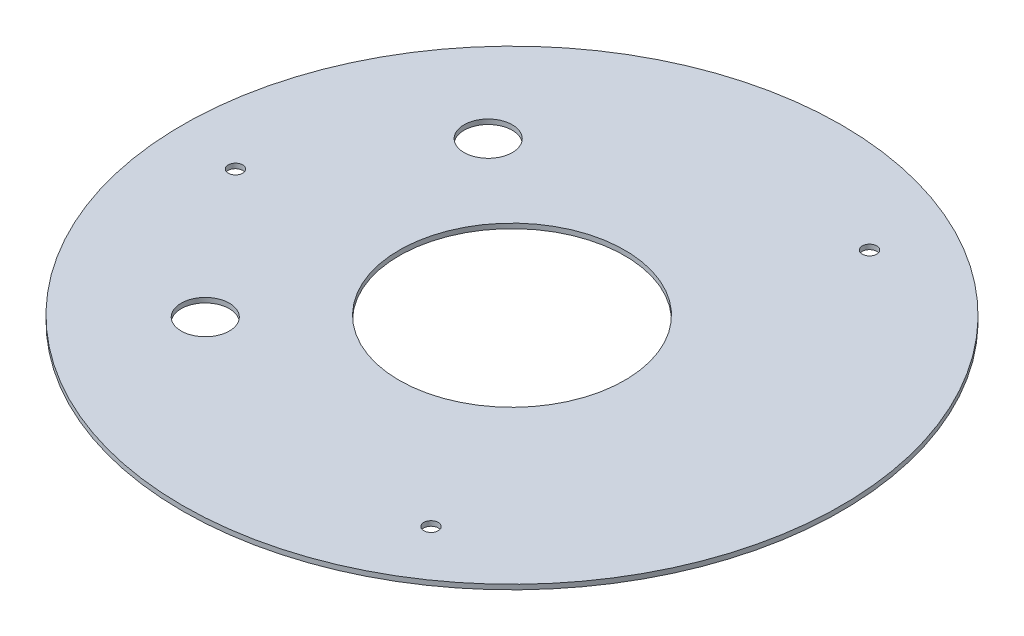
from build123d import *

# Parameters (mm, degrees)
SKETCH1_R           = 68.369999998
SKETCH1_R_2         = 23.401
BOSS_EXTRUDE1_DEPTH = 1
SKETCH2_R           = 1.5
CUT_EXTRUDE1_DEPTH  = 10
SKETCH6_R           = 5
CUT_EXTRUDE2_DEPTH  = 10


with BuildPart() as part:
    # Sketch1 → Boss-Extrude1 (new body)
    with BuildSketch(Plane(origin=(0, 0, 0), x_dir=(-1, 0, 0), z_dir=(0, 1, 0))):
        with Locations(Location((-73.249601195, 33.216650322, 0), (0, 0, 90))):
            Circle(SKETCH1_R)
        with Locations(Location((-73.249601195, 33.216650322, 0), (0, 0, 90))):
            Circle(SKETCH1_R_2, mode=Mode.SUBTRACT)
    extrude(amount=BOSS_EXTRUDE1_DEPTH)

    # Sketch2 → Cut-Extrude1 (cut)
    with BuildSketch(Plane.XZ.offset(-1)):
        with Locations(Location((18.303061139, 35.641054554, 0), (0, 0, 90))):
            Circle(SKETCH2_R)
        with Locations(Location((102.822466876, 79.589547745, 0), (0, 0, 90))):
            Circle(SKETCH2_R)
        with Locations(Location((98.623275569, -15.580651332, 0), (0, 0, 90))):
            Circle(SKETCH2_R)
    extrude(amount=CUT_EXTRUDE1_DEPTH, mode=Mode.SUBTRACT)

    # Sketch6 → Cut-Extrude2 (cut)
    with BuildSketch(Plane(origin=(47.341973048, -4, 109.358916756), x_dir=(0.09761667308977556, 0, 0.995224087899245), z_dir=(0, -1, 0))):
        with Locations(Location((-105.702188225, -2.042468777, 0), (0, 0, 5.601944352))):
            Circle(SKETCH6_R)
        with Locations(Location((-44.324158759, 1.255349618, 0), (0, 0, 5.601944352))):
            Circle(SKETCH6_R)
    extrude(amount=-CUT_EXTRUDE2_DEPTH, mode=Mode.SUBTRACT)


solid = part.part
